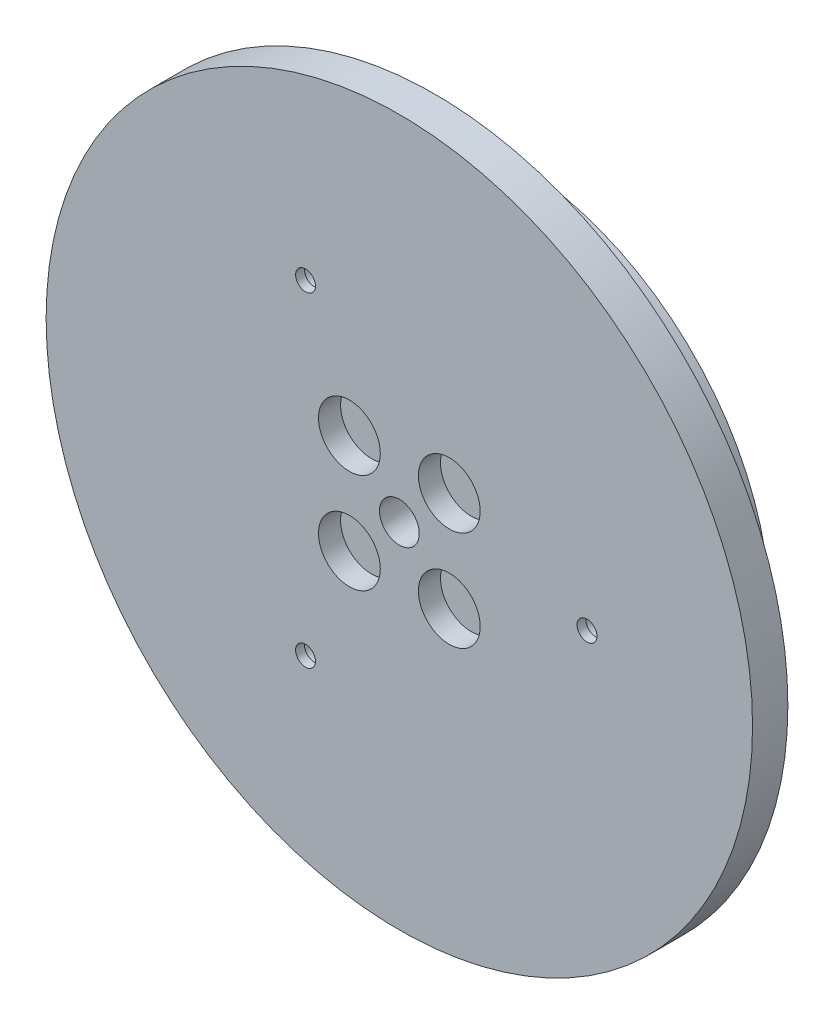
from build123d import *

# Parameters (mm, degrees)
SKETCH1_R             = 30
SKETCH1_R_2           = 12.5
BOSS_EXTRUDE1_DEPTH   = 6
SKETCH2_R             = 40
SKETCH2_R_2           = 2.25
SKETCH2_R_3           = 1.5
BOSS_EXTRUDE2_DEPTH   = 4
SKETCH3_R             = 3.5
CUT_EXTRUDE1_DEPTH    = 2.5
SKETCH4_R             = 5.15
CUT_EXTRUDE2_DEPTH    = 3
SKETCH5_R             = 3.5
BOSS_EXTRUDE3_DEPTH   = 0.2
SKETCH6_R             = 1.125
CUT_EXTRUDE3_DEPTH    = 10
SKETCH7_R             = 3.125
CUT_EXTRUDE4_DEPTH    = 9
SKETCH8_R             = 2
CUT_EXTRUDE5_DEPTH    = 8
SKETCH9_R             = 3
BOSS_EXTRUDE4_DEPTH   = 0.5
BOSS_EXTRUDE4_2_DEPTH = 0.5
BOSS_EXTRUDE4_3_DEPTH = 0.5
BOSS_EXTRUDE5_START   = 1.5
SKETCH10_R            = 30
SKETCH10_R_2          = 5.15
SKETCH10_R_3          = 12.5
SKETCH10_R_4          = 1.65
BOSS_EXTRUDE5_DEPTH   = 1.5
SKETCH11_R            = 3
SKETCH11_R_2          = 1.5
BOSS_EXTRUDE6_DEPTH   = 3
BOSS_EXTRUDE6_2_DEPTH = 3
BOSS_EXTRUDE6_3_DEPTH = 3


with BuildPart() as part:
    # Sketch1 → Boss-Extrude1 (new body)
    with BuildSketch(Plane.XY):
        Circle(SKETCH1_R)
        Circle(SKETCH1_R_2, mode=Mode.SUBTRACT)
    extrude(amount=BOSS_EXTRUDE1_DEPTH)

    # Sketch2 → Boss-Extrude2 (add)
    with BuildSketch(Plane.XY.offset(6)):
        Circle(SKETCH2_R)
        Circle(SKETCH2_R_2, mode=Mode.SUBTRACT)
        with Locations((-5.655999742, 5.657708628)):
            Circle(SKETCH2_R_3, mode=Mode.SUBTRACT)
        with Locations((-5.655999742, -5.657708628)):
            Circle(SKETCH2_R_3, mode=Mode.SUBTRACT)
        with Locations((5.655999742, -5.657708628)):
            Circle(SKETCH2_R_3, mode=Mode.SUBTRACT)
        with Locations((5.655999742, 5.657708628)):
            Circle(SKETCH2_R_3, mode=Mode.SUBTRACT)
    extrude(amount=BOSS_EXTRUDE2_DEPTH)

    # Sketch3 → Cut-Extrude1 (cut)
    with BuildSketch(Plane.XY.offset(10)):
        with Locations((-5.655999742, 5.657708628)):
            Circle(SKETCH3_R)
        with Locations((5.655999742, 5.657708628)):
            Circle(SKETCH3_R)
        with Locations((5.655999742, -5.657708628)):
            Circle(SKETCH3_R)
        with Locations((-5.655999742, -5.657708628)):
            Circle(SKETCH3_R)
    extrude(amount=-CUT_EXTRUDE1_DEPTH, mode=Mode.SUBTRACT)

    # Sketch4 → Cut-Extrude2 (cut)
    with BuildSketch(Plane(origin=(0, 0, 0), x_dir=(-1, 0, 0), z_dir=(0, 0, -1))):
        with Locations((20, 0)):
            Circle(SKETCH4_R)
    extrude(amount=-CUT_EXTRUDE2_DEPTH, mode=Mode.SUBTRACT)

    # Sketch5 → Boss-Extrude3 (add)
    with BuildSketch(Plane.XY.offset(7.5)):
        with Locations((-5.655999742, 5.657708628)):
            Circle(SKETCH5_R)
        with Locations((5.655999742, 5.657708628)):
            Circle(SKETCH5_R)
        with Locations((-5.655999742, -5.657708628)):
            Circle(SKETCH5_R)
        with Locations((5.655999742, -5.657708628)):
            Circle(SKETCH5_R)
    extrude(amount=-BOSS_EXTRUDE3_DEPTH)

    # Sketch6 → Cut-Extrude3 (cut)
    with BuildSketch(Plane(origin=(0, 0, 0), x_dir=(-1, 0, 0), z_dir=(0, 0, -1))):
        with Locations((-21.25, 0)):
            Circle(SKETCH6_R)
        with Locations((10.625, 18.40303983)):
            Circle(SKETCH6_R)
        with Locations((10.625, -18.40303983)):
            Circle(SKETCH6_R)
    extrude(amount=-CUT_EXTRUDE3_DEPTH, mode=Mode.SUBTRACT)

    # Sketch7 → Cut-Extrude4 (cut)
    with BuildSketch(Plane(origin=(0, 0, 0), x_dir=(-1, 0, 0), z_dir=(0, 0, -1))):
        with Locations((-21.25, 0)):
            Circle(SKETCH7_R)
        with Locations((10.625, 18.40303983)):
            Circle(SKETCH7_R)
        with Locations((10.625, -18.40303983)):
            Circle(SKETCH7_R)
    extrude(amount=-CUT_EXTRUDE4_DEPTH, mode=Mode.SUBTRACT)

    # Sketch8 → Cut-Extrude5 (cut)
    with BuildSketch(Plane(origin=(0, 0, 0), x_dir=(-1, 0, 0), z_dir=(0, 0, -1))):
        with Locations((-10, -17.320508076)):
            Circle(SKETCH8_R)
        with Locations((-10, 17.320508076)):
            Circle(SKETCH8_R)
    extrude(amount=-CUT_EXTRUDE5_DEPTH, mode=Mode.SUBTRACT)


with BuildPart() as body_2:
    # Sketch9 → Boss-Extrude4 (new body)
    with BuildSketch(Plane(origin=(0, 0, 0), x_dir=(-1, 0, 0), z_dir=(0, 0, -1))):
        with Locations((-21.25, 0)):
            Circle(SKETCH9_R)
    extrude(amount=BOSS_EXTRUDE4_DEPTH)



with BuildPart() as body_3:
    # Sketch9 → Boss-Extrude4 2 (new body)
    with BuildSketch(Plane(origin=(0, 0, 0), x_dir=(-1, 0, 0), z_dir=(0, 0, -1))):
        with Locations((10.625, 18.40303983)):
            Circle(SKETCH9_R)
    extrude(amount=BOSS_EXTRUDE4_2_DEPTH)


with BuildPart() as body_4:
    # Sketch9 → Boss-Extrude4 3 (new body)
    with BuildSketch(Plane(origin=(0, 0, 0), x_dir=(-1, 0, 0), z_dir=(0, 0, -1))):
        with Locations((10.625, -18.40303983)):
            Circle(SKETCH9_R)
    extrude(amount=BOSS_EXTRUDE4_3_DEPTH)


with BuildPart() as body_2_1:
    add(body_2.part)

    add(body_3.part)  # Boss-Extrude5 merges body 3

    add(body_4.part)  # Boss-Extrude5 merges body 4
    # Sketch10 → Boss-Extrude5 (add)
    with BuildSketch(Plane(origin=(0, 0, -0.5), x_dir=(-1, 0, 0), z_dir=(0, 0, -1)).offset(BOSS_EXTRUDE5_START)):
        Circle(SKETCH10_R)
        with Locations((20, 0)):
            Circle(SKETCH10_R_2, mode=Mode.SUBTRACT)
        Circle(SKETCH10_R_3, mode=Mode.SUBTRACT)
        with Locations((-10, 17.320508076)):
            Circle(SKETCH10_R_4, mode=Mode.SUBTRACT)
        with Locations((-10, -17.320508076)):
            Circle(SKETCH10_R_4, mode=Mode.SUBTRACT)
    extrude(amount=-BOSS_EXTRUDE5_DEPTH)


with BuildPart() as body_3_2:
    # Sketch11 → Boss-Extrude6 (new body)
    with BuildSketch(Plane(origin=(0, 0, 9), x_dir=(-1, 0, 0), z_dir=(0, 0, -1))):
        with Locations((-21.25, 0)):
            Circle(SKETCH11_R)
        with Locations((-21.25, 0)):
            Circle(SKETCH11_R_2, mode=Mode.SUBTRACT)
    extrude(amount=BOSS_EXTRUDE6_DEPTH)


with BuildPart() as body_4_2:
    # Sketch11 → Boss-Extrude6 2 (new body)
    with BuildSketch(Plane(origin=(0, 0, 9), x_dir=(-1, 0, 0), z_dir=(0, 0, -1))):
        with Locations((10.625, 18.40303983)):
            Circle(SKETCH11_R)
        with Locations((10.625, 18.40303983)):
            Circle(SKETCH11_R_2, mode=Mode.SUBTRACT)
    extrude(amount=BOSS_EXTRUDE6_2_DEPTH)


with BuildPart() as body_5:
    # Sketch11 → Boss-Extrude6 3 (new body)
    with BuildSketch(Plane(origin=(0, 0, 9), x_dir=(-1, 0, 0), z_dir=(0, 0, -1))):
        with Locations((10.625, -18.40303983)):
            Circle(SKETCH11_R)
        with Locations((10.625, -18.40303983)):
            Circle(SKETCH11_R_2, mode=Mode.SUBTRACT)
    extrude(amount=BOSS_EXTRUDE6_3_DEPTH)


solid = Compound([part.part, body_2_1.part, body_3_2.part, body_4_2.part, body_5.part])
